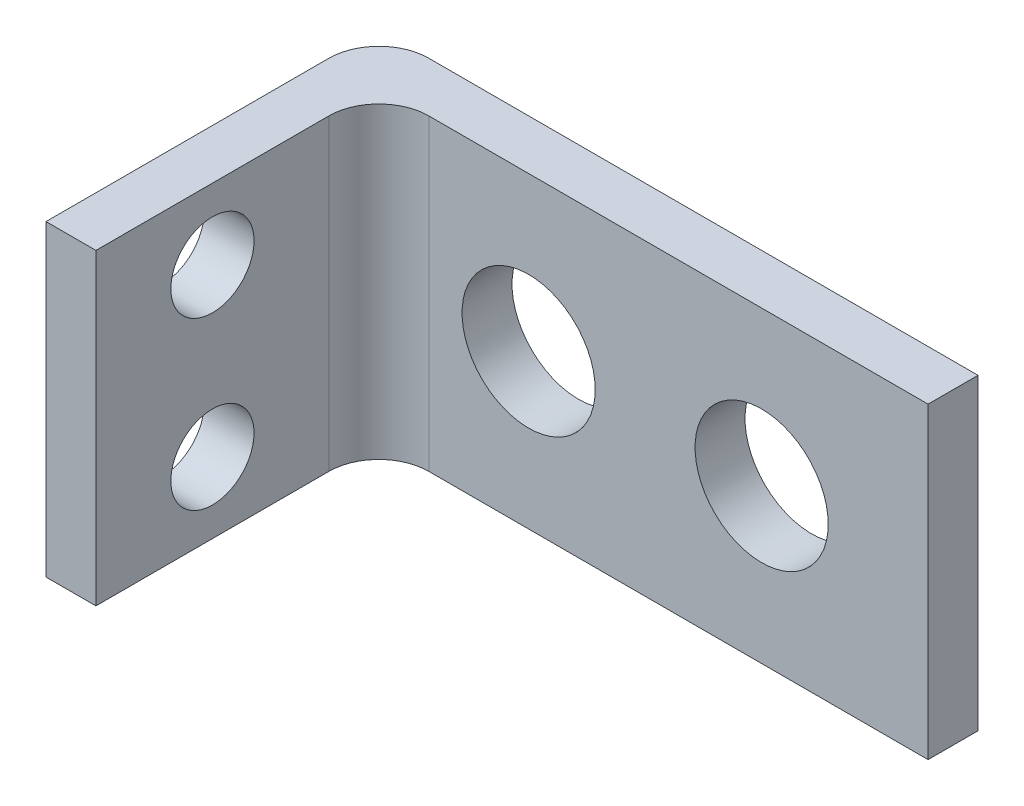
from build123d import *

# Parameters (mm, degrees)
SKETCH1_W           = 36
SKETCH1_H           = 18.5
SKETCH1_R           = 4
BOSS_EXTRUDE1_DEPTH = 3
SKETCH1_3_W         = 3
SKETCH1_3_H         = 18.5
BOSS_EXTRUDE2_DEPTH = 20
FILLET1_R           = 3
SKETCH2_R           = 2.5
CUT_EXTRUDE1_DEPTH  = 40.680757301


with BuildPart() as part:
    # Sketch1 → Boss-Extrude1 (new body)
    with BuildSketch(Plane.XY):
        with Locations((1, 0)):
            Rectangle(SKETCH1_W, SKETCH1_H)
        with Locations((9, 0)):
            Circle(SKETCH1_R, mode=Mode.SUBTRACT)
        with Locations((-5, 0)):
            Circle(SKETCH1_R, mode=Mode.SUBTRACT)
    extrude(amount=BOSS_EXTRUDE1_DEPTH)

    # Sketch1<3> → Boss-Extrude2 (add)
    with BuildSketch(Plane.XY):
        with Locations((-15.5, 0)):
            Rectangle(SKETCH1_3_W, SKETCH1_3_H)
    extrude(amount=BOSS_EXTRUDE2_DEPTH)

    # Fillet1
    fillet1_edges = [part.edges().sort_by_distance(p)[0] for p in [
        (-17, 0, 0),
        (-14, 0, 3),
    ]]
    fillet(fillet1_edges, radius=FILLET1_R)

    # Sketch2 → Cut-Extrude1 (cut, through all)
    with BuildSketch(Plane(origin=(-14, 0, 0), x_dir=(0, 0, -1), z_dir=(1, 0, 0))):
        with Locations((-13, 5)):
            Circle(SKETCH2_R)
        with Locations((-13, -5)):
            Circle(SKETCH2_R)
    extrude(amount=-CUT_EXTRUDE1_DEPTH, mode=Mode.SUBTRACT)


solid = part.part
